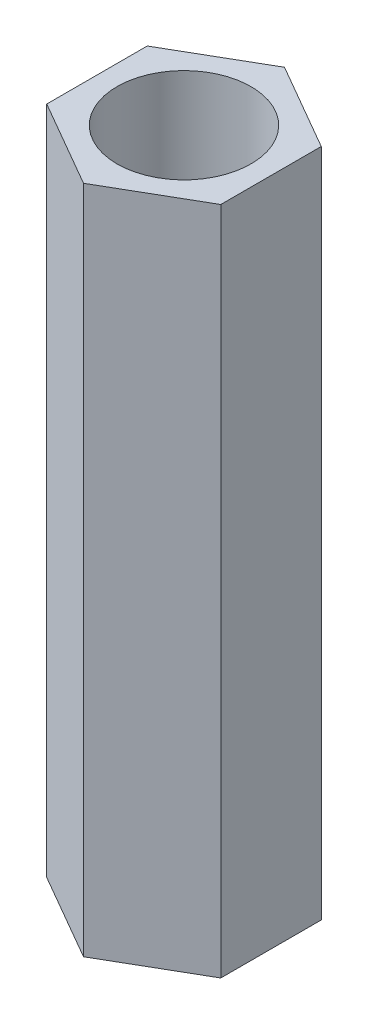
from build123d import *

# Parameters (mm, degrees)
SKETCH_1_R      = 2
EXTRUDE_1_DEPTH = 20


with BuildPart() as part:
    # 草图1 → 凸台-拉伸1 (new body)
    with BuildSketch(Plane(origin=(0, 0, 0), x_dir=(1, 0, 0), z_dir=(0, 1, 0))):
        Polygon((0, 3), (-2.598076211, 1.5), (-2.598076211, -1.5), (0, -3), (2.598076211, -1.5), (2.598076211, 1.5), align=None)
        with Locations(Location((0, 0, 0), (0, 0, 270))):
            Circle(SKETCH_1_R, mode=Mode.SUBTRACT)
    extrude(amount=EXTRUDE_1_DEPTH)


solid = part.part
